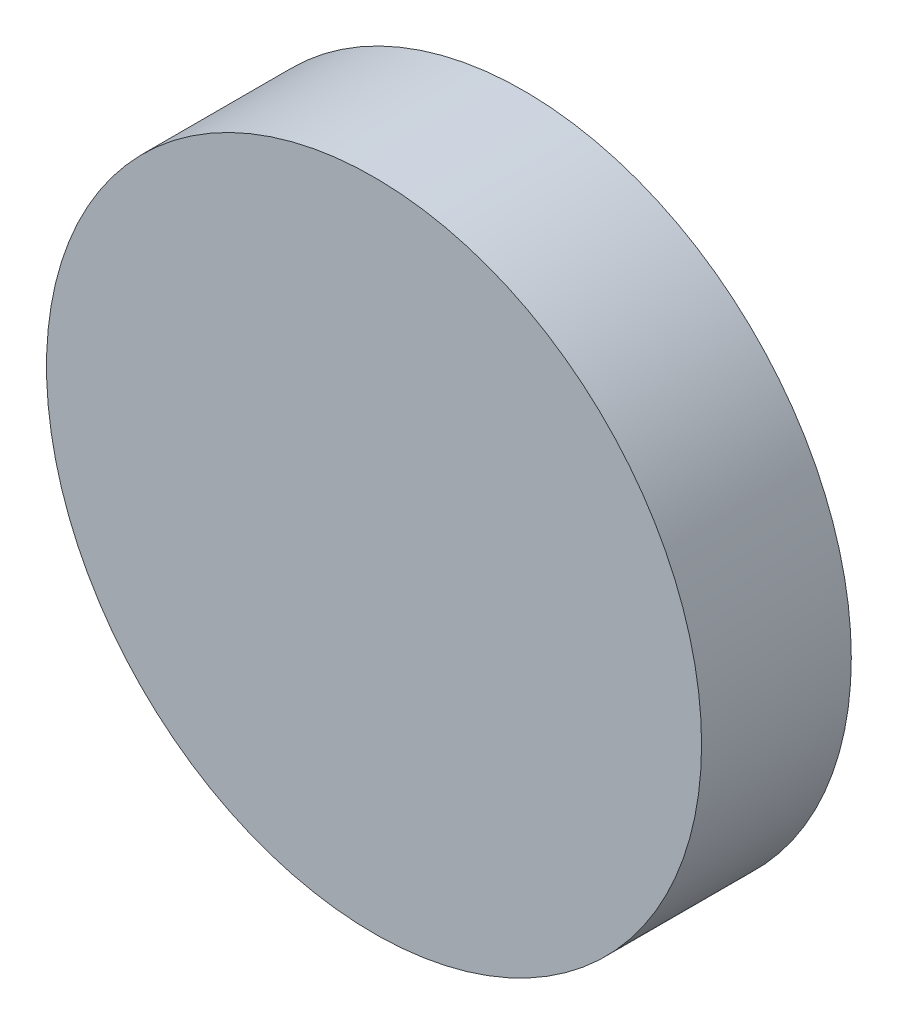
from build123d import *

# Parameters (mm, degrees)
SKETCH3_R           = 175
BOSS_EXTRUDE1_DEPTH = 80


with BuildPart() as part:
    # Sketch3 → Boss-Extrude1 (new body)
    with BuildSketch(Plane.XY):
        Circle(SKETCH3_R)
    extrude(amount=BOSS_EXTRUDE1_DEPTH)


solid = part.part
